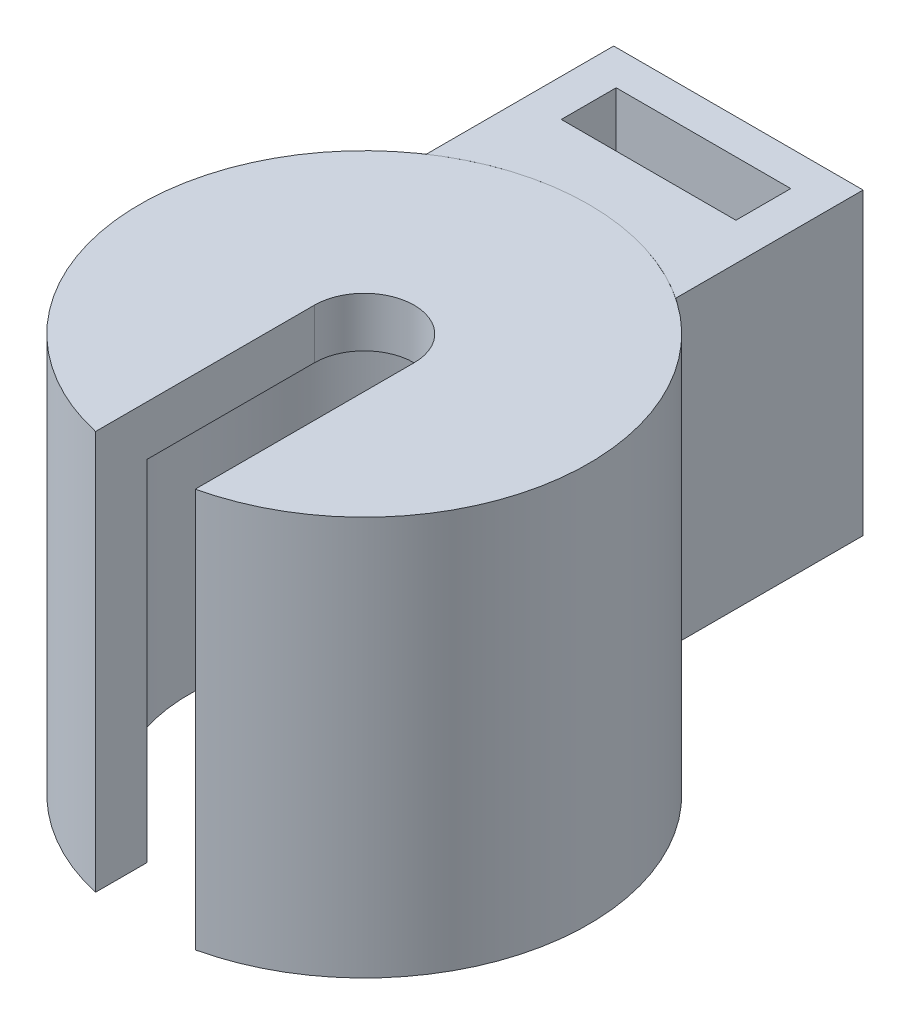
from build123d import *

# Parameters (mm, degrees)
BOSS_EXTRUDE1_DEPTH      = 7
BOSS_EXTRUDE2_DEPTH      = 1
BOSS_EXTRUDE3_DEPTH      = 2.5
BOSS_EXTRUDE3_DEPTH_BACK = 2.5
CUT_EXTRUDE1_DEPTH       = 7


with BuildPart() as part:
    # Sketch1 → Boss-Extrude1 (new body)
    with BuildSketch(Plane(origin=(0, 0, 0), x_dir=(1, 0, 0), z_dir=(0, 1, 0))):
        with BuildLine():
            Line((-1, -4.387482194), (-1, -3.354101966))
            ThreePointArc((-1, -3.354101966), (-2.091650066, 2.80624304), (3.5, 0))
            ThreePointArc((3.5, 0), (2.80624304, -2.091650066), (1, -3.354101966))
            Line((1, -3.354101966), (1, -4.387482194))
            ThreePointArc((1, -4.387482194), (3.51781182, -2.80624304), (4.5, 0))
            ThreePointArc((4.5, 0), (-2.80624304, 3.51781182), (-1, -4.387482194))
        make_face()
    extrude(amount=BOSS_EXTRUDE1_DEPTH)

    # Sketch2 → Boss-Extrude2 (add)
    with BuildSketch(Plane(origin=(0, 7, 0), x_dir=(1, 0, 0), z_dir=(0, 1, 0))):
        with BuildLine():
            Line((-1, -3.354101966), (-1, 0))
            ThreePointArc((-1, 0), (0, 1), (1, 0))
            Line((1, 0), (1, -3.354101966))
            ThreePointArc((1, -3.354101966), (0, 3.5), (-1, -3.354101966))
        make_face()
        with BuildLine():
            ThreePointArc((-1, -3.354101966), (0, 3.5), (1, -3.354101966))
            Line((1, -3.354101966), (1, -4.387482194))
            ThreePointArc((1, -4.387482194), (0, 4.5), (-1, -4.387482194))
            Line((-1, -4.387482194), (-1, -3.354101966))
        make_face()
    extrude(amount=BOSS_EXTRUDE2_DEPTH)

    # Sketch3 → Boss-Extrude3 (add, two sides: drawn at the far end of the back side and taken through both)
    with BuildSketch(Plane(origin=(0, 0, 0), x_dir=(0, 0, -1), z_dir=(1, 0, 0)).offset(-BOSS_EXTRUDE3_DEPTH_BACK)):
        Polygon((7.5, 7.999), (4.5, 7.999), (3.5, 7.999), (3.5, 1.999), (7.5, 1.999), align=None)
    extrude(amount=BOSS_EXTRUDE3_DEPTH + BOSS_EXTRUDE3_DEPTH_BACK)

    # Sketch4 → Cut-Extrude1 (cut)
    with BuildSketch(Plane(origin=(0, 7.999, 0), x_dir=(1, 0, 0), z_dir=(0, 1, 0))):
        Polygon((1.75, 6.8), (0, 6.8), (-1.75, 6.8), (-1.75, 5.7), (1.75, 5.7), align=None)
    extrude(amount=-CUT_EXTRUDE1_DEPTH, mode=Mode.SUBTRACT)


solid = part.part
